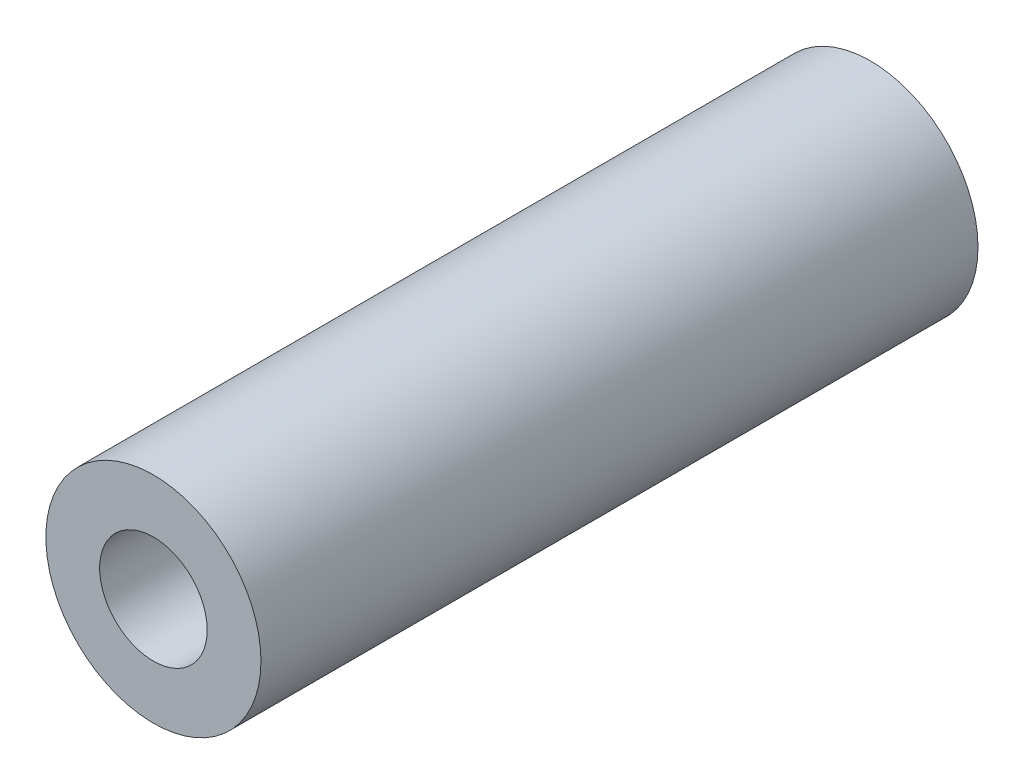
from build123d import *

# Parameters (mm, degrees)
SKETCH1_R           = 9
SKETCH1_R_2         = 4.5
BOSS_EXTRUDE1_DEPTH = 60


with BuildPart() as part:
    # Sketch1 → Boss-Extrude1 (new body)
    with BuildSketch(Plane.XY):
        Circle(SKETCH1_R)
        Circle(SKETCH1_R_2, mode=Mode.SUBTRACT)
    extrude(amount=BOSS_EXTRUDE1_DEPTH)


solid = part.part
